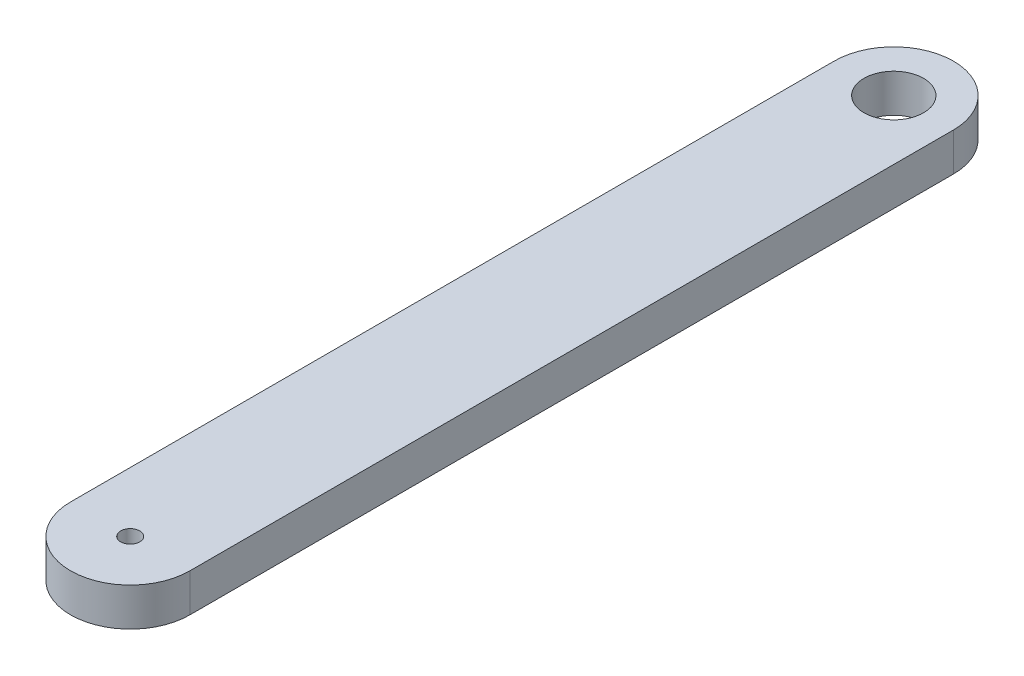
from build123d import *

# Parameters (mm, degrees)
SKETCH1_R           = 6.25
SKETCH1_R_2         = 2
BOSS_EXTRUDE1_DEPTH = 8


with BuildPart() as part:
    # Sketch1 → Boss-Extrude1 (new body)
    with BuildSketch(Plane(origin=(0, 0, 0), x_dir=(1, 0, 0), z_dir=(0, 1, 0))):
        with BuildLine():
            ThreePointArc((12.5, 160), (0, 172.5), (-12.5, 160))
            Line((-12.5, 160), (-12.5, 0))
            ThreePointArc((-12.5, 0), (0, -12.5), (12.5, 0))
            Line((12.5, 0), (12.5, 160))
        make_face()
        with Locations(Location((0, 160, 0), (0, 0, 270))):
            Circle(SKETCH1_R, mode=Mode.SUBTRACT)
        with Locations(Location((0, 0, 0), (0, 0, 270))):
            Circle(SKETCH1_R_2, mode=Mode.SUBTRACT)
    extrude(amount=BOSS_EXTRUDE1_DEPTH)


solid = part.part
